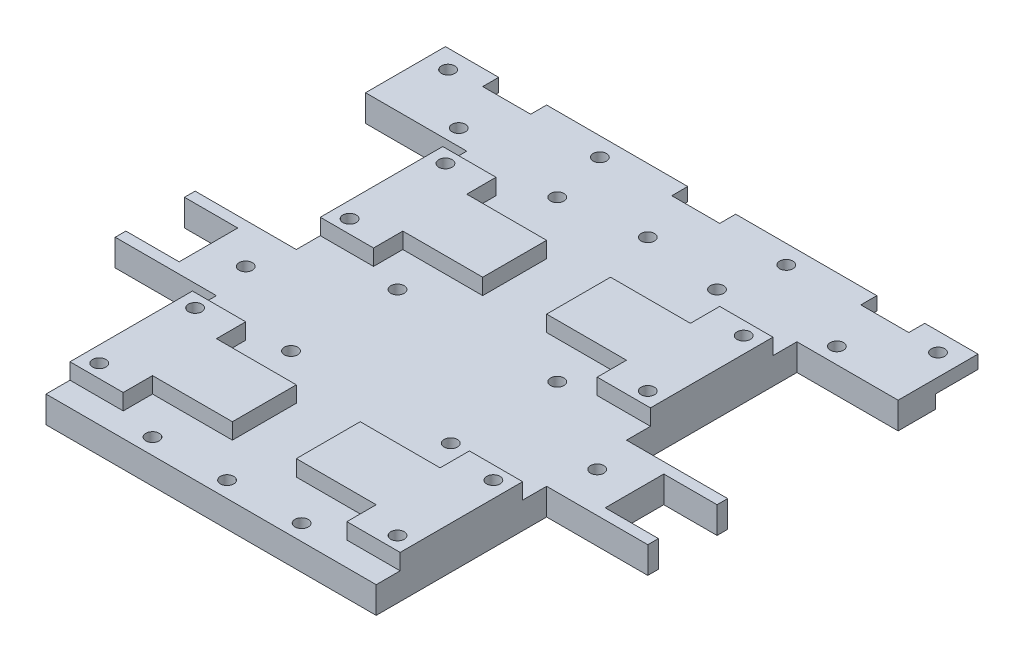
from build123d import *

# Parameters (mm, degrees)
KSZTA_T_OGOLNY_DEPTH            = 5
MIEJSCE_NA_SHARPY_DEPTH         = 19
MIEJSCE_NA_SHARPY_DEPTH_BACK    = 16.272781758
WCI_CIE_NA_SHARP_W              = 10
WCI_CIE_NA_SHARP_H              = 11
WCI_CIE_NA_PO_CZENIEP_UGU_W     = 100
WCI_CIE_NA_PO_CZENIEP_UGU_H     = 8
MIEJSCE_NA_P_UG_DEPTH           = 2.5
WCI_CIA_NA_KTIRY_W              = 9
WCI_CIA_NA_KTIRY_H              = 14
MIEJSCE_NA_KTIR_DEPTH           = 2.5
SILNIKI_START                   = 5
PODWY_SZENIE_NA_SILNIKI_R       = 1.25
SILNIKI_PODWYZSZENIE_DEPTH      = 3
SILNIKI_DZIURY_DEPTH            = 35
SILNIKI_DZIURY_DEPTH_BACK       = 31
PODWY_SZENIE_NA_SILNIKI_3_R     = 1.25
OTWORY_NA_P_UG_DEPTH            = 42
OTWORY_NA_P_UG_DEPTH_BACK       = 56
OTWORY_NA_P_UG_2_R              = 1.25
OTWORY_TY_DEPTH                 = 54
OTWORY_TY_DEPTH_BACK            = 71
OTWORY_TY_RYS_R                 = 1.25
OTWORY_NA_PCB_DEPTH             = 40
OTWORY_NA_PCB_DEPTH_BACK        = 40.893066204
OTWORY_RYS_R                    = 1.25
KABLE_KTIR_DEPTH                = 61
KABLE_KTIR_DEPTH_BACK           = 85.532250354
MIEJSCE_NA_KABLE_KTIR_W         = 9
MIEJSCE_NA_KABLE_KTIR_H         = 3
OTWORY_MOCUJACE_KTIR_DEPTH      = 70
OTWORY_MOCUJACE_KTIR_DEPTH_BACK = 110.581826372
OTWORY_NA_MOCOWANIE_KTIR_RYS_R  = 1.25
ZAOKR_GLENIE1_R                 = 1


with BuildPart() as part:
    # Kształt ogólny → Kształt ogolny (new body)
    with BuildSketch(Plane(origin=(0, 0, 0), x_dir=(1, 0, 0), z_dir=(0, 1, 0))):
        Polygon((0, 0), (-100, 0), (-100, -15), (-81, -15), (-81, -47), (-100, -47), (-100, -62), (-81, -62), (-81, -94), (-19, -94), (-19, -62), (0, -62), (0, -47), (-19, -47), (-19, -15), (0, -15), align=None)
    extrude(amount=KSZTA_T_OGOLNY_DEPTH)

    # Wcięcie na sharp → Miejsce na sharpy (cut, two sides: drawn at the far end of the back side and taken through both)
    with BuildSketch(Plane(origin=(0, 5, 0), x_dir=(1, 0, 0), z_dir=(0, 1, 0)).offset(-MIEJSCE_NA_SHARPY_DEPTH_BACK)):
        with Locations((-95, -54.5)):
            Rectangle(WCI_CIE_NA_SHARP_W, WCI_CIE_NA_SHARP_H)
        with Locations((-5, -54.5)):
            Rectangle(WCI_CIE_NA_SHARP_W, WCI_CIE_NA_SHARP_H)
    extrude(amount=MIEJSCE_NA_SHARPY_DEPTH + MIEJSCE_NA_SHARPY_DEPTH_BACK, mode=Mode.SUBTRACT)

    # Wcięcie na połączeniepługu → Miejsce na pług (cut)
    with BuildSketch(Plane(origin=(0, 0, 0), x_dir=(1, 0, 0), z_dir=(0, 1, 0))):
        with Locations((-50, -4)):
            Rectangle(WCI_CIE_NA_PO_CZENIEP_UGU_W, WCI_CIE_NA_PO_CZENIEP_UGU_H)
    extrude(amount=MIEJSCE_NA_P_UG_DEPTH, mode=Mode.SUBTRACT)

    # Wcięcia na ktiry → Miejsce na ktir (cut)
    with BuildSketch(Plane(origin=(0, 0, 0), x_dir=(1, 0, 0), z_dir=(0, 1, 0))):
        with Locations((-85.5, -7)):
            Rectangle(WCI_CIA_NA_KTIRY_W, WCI_CIA_NA_KTIRY_H)
        with Locations((-50, -7)):
            Rectangle(WCI_CIA_NA_KTIRY_W, WCI_CIA_NA_KTIRY_H)
        with Locations((-14.5, -7)):
            Rectangle(WCI_CIA_NA_KTIRY_W, WCI_CIA_NA_KTIRY_H)
    extrude(amount=MIEJSCE_NA_KTIR_DEPTH, mode=Mode.SUBTRACT)

    # Podwyższenie na silniki → Silniki - podwyzszenie (add)
    # profile 1 of 4: a face of its own
    with BuildSketch(Plane(origin=(0, 0, 0), x_dir=(1, 0, 0), z_dir=(0, 1, 0)).offset(SILNIKI_START)):
        Polygon((-81, -66.5), (-71, -66.5), (-71, -72), (-56, -72), (-56, -84), (-71, -84), (-71, -89.5), (-81, -89.5), align=None)
        with Locations(Location((-78, -69, 0), (0, 0, 270))):
            Circle(PODWY_SZENIE_NA_SILNIKI_R, mode=Mode.SUBTRACT)
        with Locations(Location((-78, -87, 0), (0, 0, 270))):
            Circle(PODWY_SZENIE_NA_SILNIKI_R, mode=Mode.SUBTRACT)
    # profile 2 of 4: a face of its own
    with BuildSketch(Plane(origin=(0, 0, 0), x_dir=(1, 0, 0), z_dir=(0, 1, 0)).offset(SILNIKI_START)):
        Polygon((-19, -89.5), (-29, -89.5), (-29, -84), (-44, -84), (-44, -72), (-29, -72), (-29, -66.5), (-19, -66.5), align=None)
        with Locations(Location((-22, -69, 0), (0, 0, 270))):
            Circle(PODWY_SZENIE_NA_SILNIKI_R, mode=Mode.SUBTRACT)
        with Locations(Location((-22, -87, 0), (0, 0, 270))):
            Circle(PODWY_SZENIE_NA_SILNIKI_R, mode=Mode.SUBTRACT)
    # profile 3 of 4: a face of its own
    with BuildSketch(Plane(origin=(0, 0, 0), x_dir=(1, 0, 0), z_dir=(0, 1, 0)).offset(SILNIKI_START)):
        Polygon((-81, -19.5), (-71, -19.5), (-71, -25), (-56, -25), (-56, -37), (-71, -37), (-71, -42.5), (-81, -42.5), align=None)
        with Locations(Location((-78, -22, 0), (0, 0, 270))):
            Circle(PODWY_SZENIE_NA_SILNIKI_R, mode=Mode.SUBTRACT)
        with Locations(Location((-78, -40, 0), (0, 0, 270))):
            Circle(PODWY_SZENIE_NA_SILNIKI_R, mode=Mode.SUBTRACT)
    # profile 4 of 4: a face of its own
    with BuildSketch(Plane(origin=(0, 0, 0), x_dir=(1, 0, 0), z_dir=(0, 1, 0)).offset(SILNIKI_START)):
        Polygon((-19, -19.5), (-29, -19.5), (-29, -25), (-44, -25), (-44, -37), (-29, -37), (-29, -42.5), (-19, -42.5), align=None)
        with Locations(Location((-22, -22, 0), (0, 0, 270))):
            Circle(PODWY_SZENIE_NA_SILNIKI_R, mode=Mode.SUBTRACT)
        with Locations(Location((-22, -40, 0), (0, 0, 270))):
            Circle(PODWY_SZENIE_NA_SILNIKI_R, mode=Mode.SUBTRACT)
    extrude(amount=SILNIKI_PODWYZSZENIE_DEPTH)

    # Podwyższenie na silniki<3> → Silniki -dziury (cut, two sides: drawn at the far end of the back side and taken through both)
    with BuildSketch(Plane(origin=(0, 0, 0), x_dir=(1, 0, 0), z_dir=(0, 1, 0)).offset(-SILNIKI_DZIURY_DEPTH_BACK)):
        with Locations(Location((-78, -87, 0), (0, 0, 270))):
            Circle(PODWY_SZENIE_NA_SILNIKI_3_R)
        with Locations(Location((-78, -69, 0), (0, 0, 270))):
            Circle(PODWY_SZENIE_NA_SILNIKI_3_R)
        with Locations(Location((-78, -40, 0), (0, 0, 270))):
            Circle(PODWY_SZENIE_NA_SILNIKI_3_R)
        with Locations(Location((-78, -22, 0), (0, 0, 270))):
            Circle(PODWY_SZENIE_NA_SILNIKI_3_R)
        with Locations(Location((-22, -22, 0), (0, 0, 270))):
            Circle(PODWY_SZENIE_NA_SILNIKI_3_R)
        with Locations(Location((-22, -40, 0), (0, 0, 270))):
            Circle(PODWY_SZENIE_NA_SILNIKI_3_R)
        with Locations(Location((-22, -69, 0), (0, 0, 270))):
            Circle(PODWY_SZENIE_NA_SILNIKI_3_R)
        with Locations(Location((-22, -87, 0), (0, 0, 270))):
            Circle(PODWY_SZENIE_NA_SILNIKI_3_R)
    extrude(amount=SILNIKI_DZIURY_DEPTH + SILNIKI_DZIURY_DEPTH_BACK, mode=Mode.SUBTRACT)

    # Otwory na p_ug 2 → Otwory na p_ug (cut, two sides: drawn at the far end of the back side and taken through both)
    with BuildSketch(Plane(origin=(0, 0, 0), x_dir=(1, 0, 0), z_dir=(0, 1, 0)).offset(-OTWORY_NA_P_UG_DEPTH_BACK)):
        with Locations(Location((-96, -3.5, 0), (0, 0, 90))):
            Circle(OTWORY_NA_P_UG_2_R)
        with Locations(Location((-67.5, -3.5, 0), (0, 0, 90))):
            Circle(OTWORY_NA_P_UG_2_R)
        with Locations(Location((-32.5, -3.5, 0), (0, 0, 90))):
            Circle(OTWORY_NA_P_UG_2_R)
        with Locations(Location((-4, -3.5, 0), (0, 0, 90))):
            Circle(OTWORY_NA_P_UG_2_R)
    extrude(amount=OTWORY_NA_P_UG_DEPTH + OTWORY_NA_P_UG_DEPTH_BACK, mode=Mode.SUBTRACT)

    # Otwory tył(rys) → Otwory tył (cut, two sides: drawn at the far end of the back side and taken through both)
    with BuildSketch(Plane(origin=(0, 0, 0), x_dir=(1, 0, 0), z_dir=(0, 1, 0)).offset(-OTWORY_TY_DEPTH_BACK)):
        with Locations(Location((-50, -91, 0), (0, 0, 270))):
            Circle(OTWORY_TY_RYS_R)
        with Locations(Location((-36, -91, 0), (0, 0, 270))):
            Circle(OTWORY_TY_RYS_R)
        with Locations(Location((-64, -91, 0), (0, 0, 270))):
            Circle(OTWORY_TY_RYS_R)
    extrude(amount=OTWORY_TY_DEPTH + OTWORY_TY_DEPTH_BACK, mode=Mode.SUBTRACT)

    # Otwory rys → Otwory na pcb (cut, two sides: drawn at the far end of the back side and taken through both)
    with BuildSketch(Plane(origin=(0, 0, 0), x_dir=(1, 0, 0), z_dir=(0, 1, 0)).offset(-OTWORY_NA_PCB_DEPTH_BACK)):
        with Locations(Location((-65, -44, 0), (0, 0, 90))):
            Circle(OTWORY_RYS_R)
        with Locations(Location((-35, -44, 0), (0, 0, 90))):
            Circle(OTWORY_RYS_R)
        with Locations(Location((-35, -64, 0), (0, 0, 90))):
            Circle(OTWORY_RYS_R)
        with Locations(Location((-65, -64, 0), (0, 0, 90))):
            Circle(OTWORY_RYS_R)
        with Locations(Location((-65, -14, 0), (0, 0, 90))):
            Circle(OTWORY_RYS_R)
        with Locations(Location((-35, -14, 0), (0, 0, 90))):
            Circle(OTWORY_RYS_R)
        with Locations(Location((-83, -54.5, 0), (0, 0, 90))):
            Circle(OTWORY_RYS_R)
        with Locations(Location((-17, -54.5, 0), (0, 0, 90))):
            Circle(OTWORY_RYS_R)
    extrude(amount=OTWORY_NA_PCB_DEPTH + OTWORY_NA_PCB_DEPTH_BACK, mode=Mode.SUBTRACT)

    # Miejsce na kable ktir → Kable ktir (cut, two sides: drawn at the far end of the back side and taken through both)
    with BuildSketch(Plane(origin=(0, 2.5, 0), x_dir=(-1, 0, 0), z_dir=(0, -1, 0)).offset(-KABLE_KTIR_DEPTH_BACK)):
        with Locations((14.5, -1.5)):
            Rectangle(MIEJSCE_NA_KABLE_KTIR_W, MIEJSCE_NA_KABLE_KTIR_H)
        with Locations((50, -1.5)):
            Rectangle(MIEJSCE_NA_KABLE_KTIR_W, MIEJSCE_NA_KABLE_KTIR_H)
        with Locations((85.5, -1.5)):
            Rectangle(MIEJSCE_NA_KABLE_KTIR_W, MIEJSCE_NA_KABLE_KTIR_H)
    extrude(amount=KABLE_KTIR_DEPTH + KABLE_KTIR_DEPTH_BACK, mode=Mode.SUBTRACT)

    # Otwory na mocowanie ktir rys → Otwory mocujace ktir (cut, two sides: drawn at the far end of the back side and taken through both)
    with BuildSketch(Plane(origin=(0, 2.5, 0), x_dir=(-1, 0, 0), z_dir=(0, -1, 0)).offset(-OTWORY_MOCUJACE_KTIR_DEPTH_BACK)):
        with Locations(Location((14.5, -12, 0), (0, 0, 270))):
            Circle(OTWORY_NA_MOCOWANIE_KTIR_RYS_R)
        with Locations(Location((50, -12, 0), (0, 0, 270))):
            Circle(OTWORY_NA_MOCOWANIE_KTIR_RYS_R)
        with Locations(Location((85.5, -12, 0), (0, 0, 270))):
            Circle(OTWORY_NA_MOCOWANIE_KTIR_RYS_R)
    extrude(amount=OTWORY_MOCUJACE_KTIR_DEPTH + OTWORY_MOCUJACE_KTIR_DEPTH_BACK, mode=Mode.SUBTRACT)

    # Zaokrąglenie1
    zaokr_glenie1_edges = [part.edges().sort_by_distance(p)[0] for p in [
        (-78, 0, 67.75),
        (-78, 0, 38.75),
        (-78, 0, 20.75),
        (-22, 0, 20.75),
        (-22, 0, 38.75),
        (-22, 0, 67.75),
        (-22, 0, 85.75),
        (-78, 0, 85.75),
        (-64, 0, 89.75),
        (-36, 0, 89.75),
        (-50, 0, 89.75),
        (-35, 0, 45.25),
        (-35, 0, 65.25),
        (-65, 0, 65.25),
        (-65, 0, 15.25),
        (-35, 0, 15.25),
        (-83, 0, 55.75),
        (-17, 0, 55.75),
        (-65, 0, 45.25),
    ]]
    fillet(zaokr_glenie1_edges, radius=ZAOKR_GLENIE1_R)


solid = part.part
